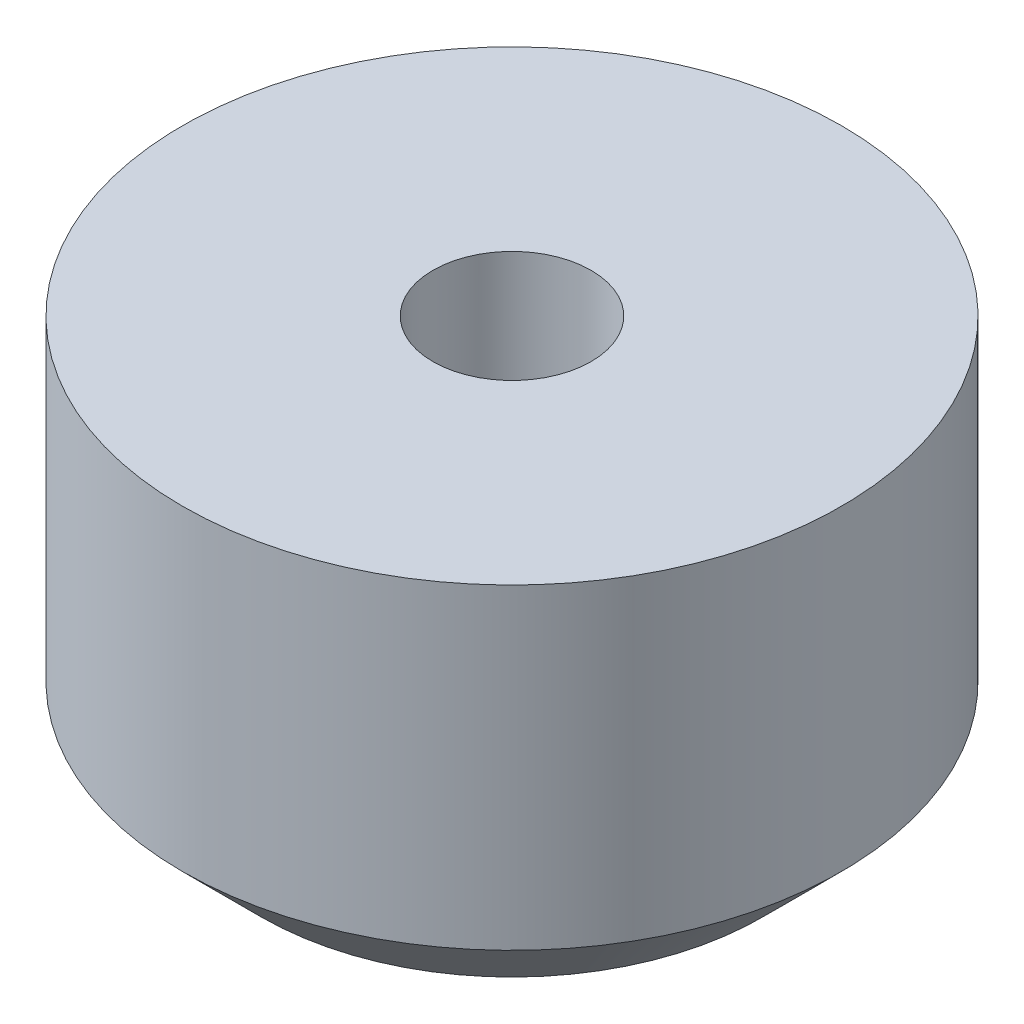
from build123d import *

# Parameters (mm, degrees)
SKETCH1_R           = 12.5
SKETCH1_R_2         = 3
BOSS_EXTRUDE1_DEPTH = 15
CHAMFER1_SIZE       = 3
SKETCH2_R           = 6
CUT_EXTRUDE1_DEPTH  = 7


with BuildPart() as part:
    # Sketch1 → Boss-Extrude1 (new body)
    with BuildSketch(Plane(origin=(0, 0, 0), x_dir=(1, 0, 0), z_dir=(0, 1, 0))):
        with Locations(Location((0, 0, 0), (0, 0, 270))):
            Circle(SKETCH1_R)
        with Locations(Location((0, 0, 0), (0, 0, 270))):
            Circle(SKETCH1_R_2, mode=Mode.SUBTRACT)
    extrude(amount=BOSS_EXTRUDE1_DEPTH)

    # Chamfer1
    chamfer1_edges = [part.edges().sort_by_distance(p)[0] for p in [
        (0, 0, -12.5),
    ]]
    chamfer(chamfer1_edges, length=CHAMFER1_SIZE)

    # Sketch2 → Cut-Extrude1 (cut)
    with BuildSketch(Plane.XZ):
        with Locations(Location((0, 0, 0), (0, 0, 270))):
            Circle(SKETCH2_R)
    extrude(amount=-CUT_EXTRUDE1_DEPTH, mode=Mode.SUBTRACT)


solid = part.part
